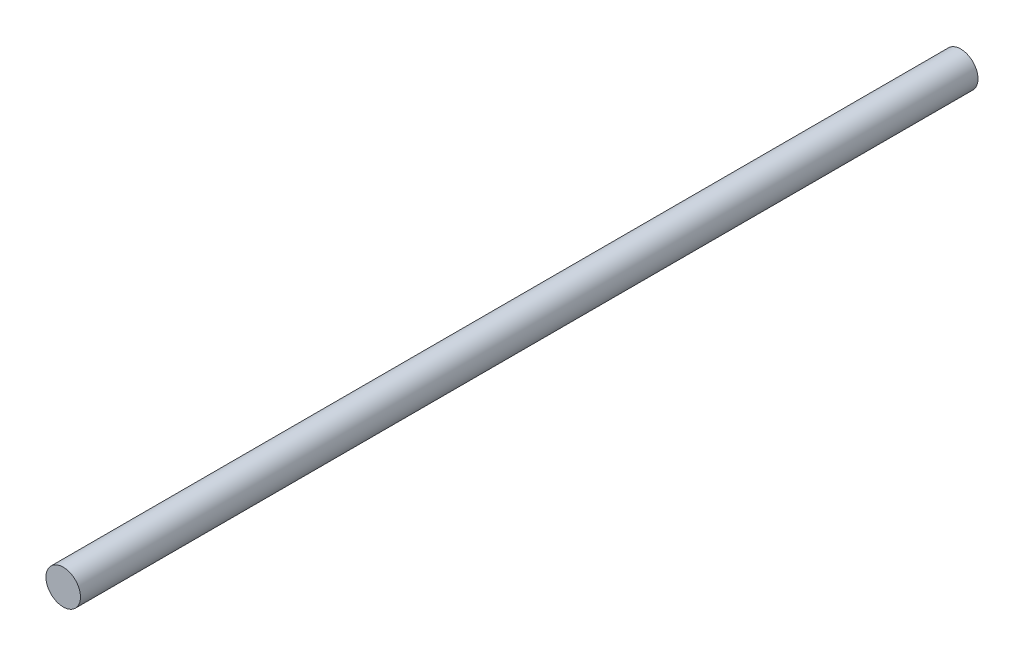
from build123d import *

# Parameters (mm, degrees)
SKETCH1_R           = 5
BOSS_EXTRUDE1_DEPTH = 260


with BuildPart() as part:
    # Sketch1 → Boss-Extrude1 (new body)
    with BuildSketch(Plane.XY):
        Circle(SKETCH1_R)
    extrude(amount=BOSS_EXTRUDE1_DEPTH)


solid = part.part
